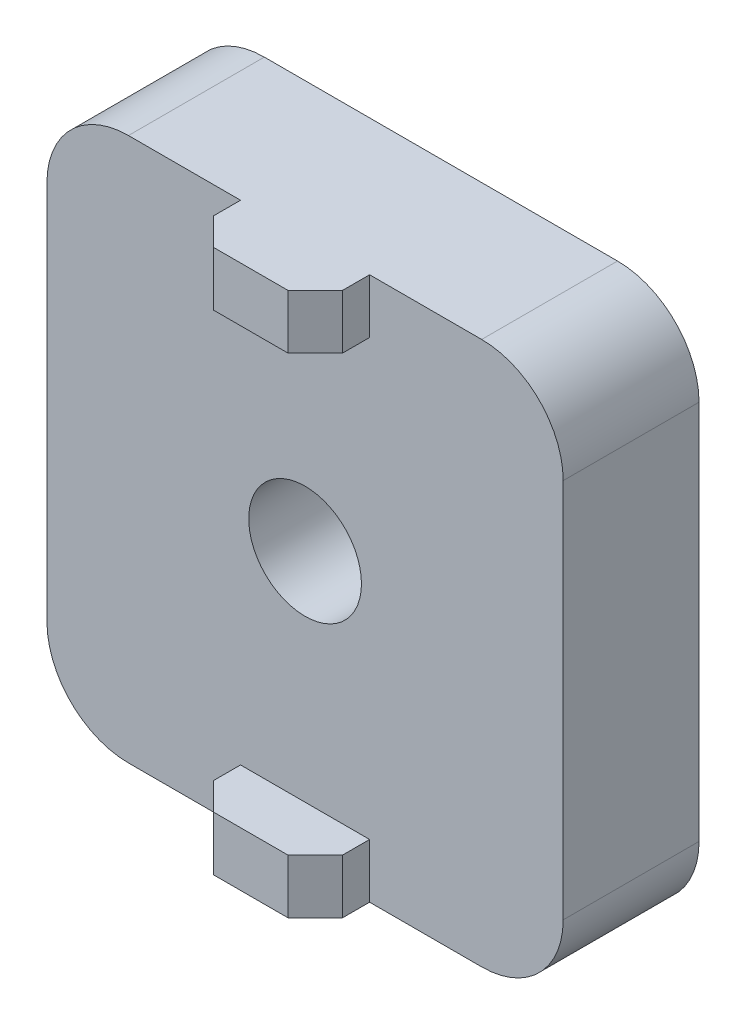
from build123d import *

# Parameters (mm, degrees)
SKETCH1_W           = 38
SKETCH1_H           = 40
SKETCH1_R           = 4.15
BOSS_EXTRUDE1_DEPTH = 5
FILLET1_R           = 6
SKETCH2_W           = 9.5
SKETCH2_H           = 4
BOSS_EXTRUDE2_DEPTH = 4
CHAMFER1_SIZE       = 2


with BuildPart() as part:
    # Sketch1 → Boss-Extrude1 (new, symmetric)
    with BuildSketch(Plane.XY):
        Rectangle(SKETCH1_W, SKETCH1_H)
        Circle(SKETCH1_R, mode=Mode.SUBTRACT)
    extrude(amount=BOSS_EXTRUDE1_DEPTH, both=True)

    # Fillet1
    fillet1_edges = [part.edges().sort_by_distance(p)[0] for p in [
        (19, -20, 0),
        (-19, -20, 0),
        (-19, 20, 0),
        (19, 20, 0),
    ]]
    fillet(fillet1_edges, radius=FILLET1_R)

    # Sketch2 → Boss-Extrude2 (add)
    with BuildSketch(Plane.XY.offset(5)):
        with Locations((0, 18)):
            Rectangle(SKETCH2_W, SKETCH2_H)
        with Locations((0, -18)):
            Rectangle(SKETCH2_W, SKETCH2_H)
    extrude(amount=BOSS_EXTRUDE2_DEPTH)

    # Chamfer1
    chamfer1_edges = [part.edges().sort_by_distance(p)[0] for p in [
        (4.75, 18, 9),
        (-4.75, 18, 9),
        (-4.75, -18, 9),
        (4.75, -18, 9),
    ]]
    chamfer(chamfer1_edges, length=CHAMFER1_SIZE)


solid = part.part
